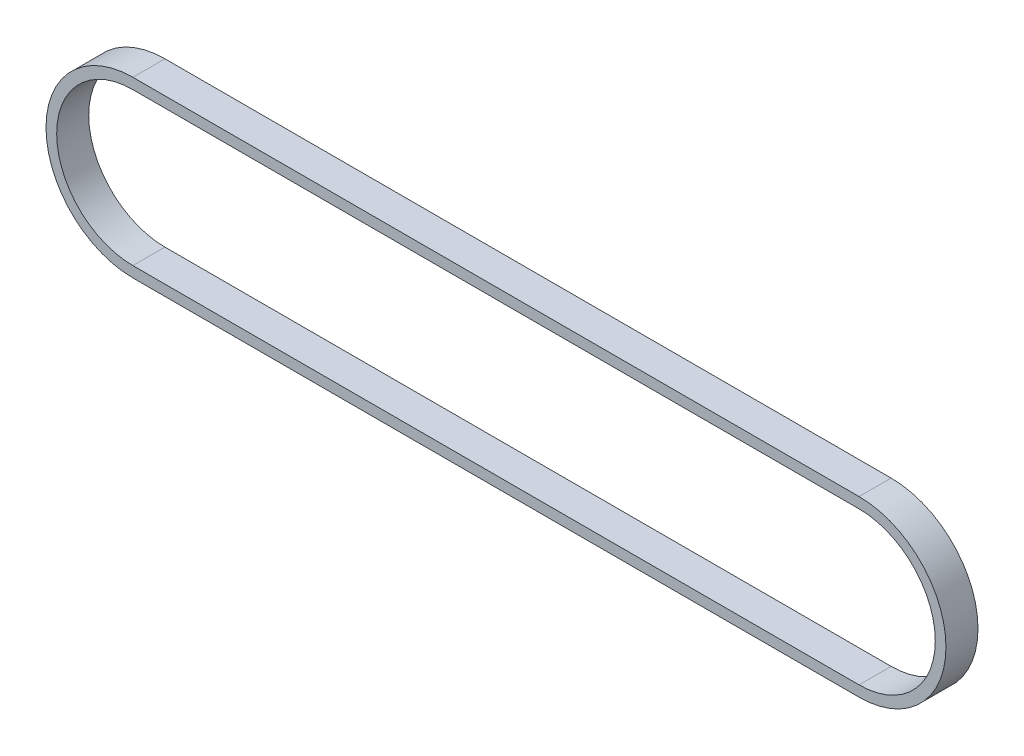
from build123d import *

# Parameters (mm, degrees)
RESSALTO_EXTRUS_O1_DEPTH = 4.5


with BuildPart() as part:
    # Esboço1 → Ressalto-extrusão1 (new, symmetric)
    with BuildSketch(Plane.XY):
        with BuildLine():
            ThreePointArc((203.94484, -24.4), (228.34484, 0), (203.94484, 24.4))
            Line((203.94484, 24.4), (0, 24.4))
            ThreePointArc((0, 24.4), (-24.4, 0), (0, -24.4))
            Line((0, -24.4), (203.94484, -24.4))
        make_face()
        with BuildLine():
            ThreePointArc((0, -21.4), (-21.4, 0), (0, 21.4))
            Line((0, 21.4), (203.94484, 21.4))
            ThreePointArc((203.94484, 21.4), (225.34484, 0), (203.94484, -21.4))
            Line((203.94484, -21.4), (0, -21.4))
        make_face(mode=Mode.SUBTRACT)
    extrude(amount=RESSALTO_EXTRUS_O1_DEPTH, both=True)


solid = part.part
